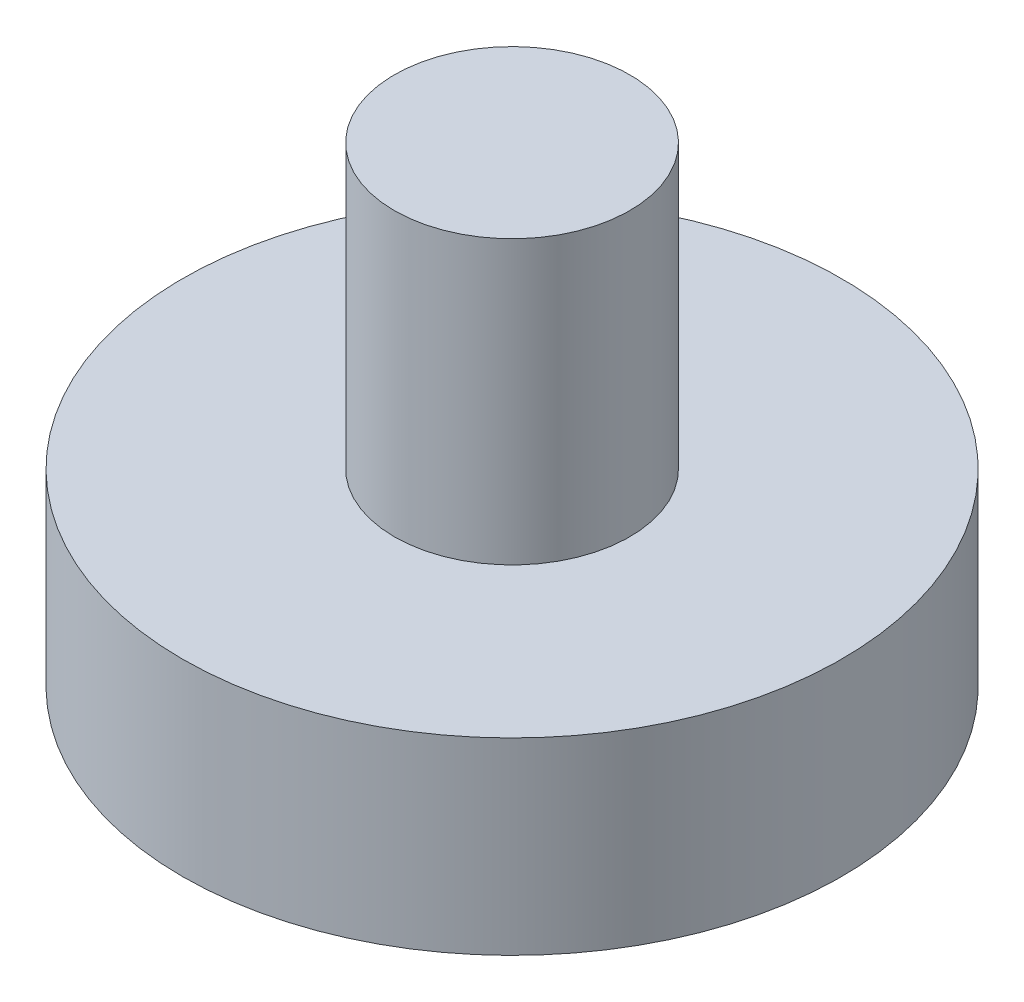
from build123d import *

# Parameters (mm, degrees)
SKETCH1_R           = 3.5
BOSS_EXTRUDE1_DEPTH = 2
SKETCH2_R           = 1.25
BOSS_EXTRUDE2_DEPTH = 3


with BuildPart() as part:
    # Sketch1 → Boss-Extrude1 (new body)
    with BuildSketch(Plane(origin=(0, 0, 0), x_dir=(1, 0, 0), z_dir=(0, 1, 0))):
        with Locations(Location((0, 0, 0), (0, 0, 270))):
            Circle(SKETCH1_R)
    extrude(amount=BOSS_EXTRUDE1_DEPTH)

    # Sketch2 → Boss-Extrude2 (add)
    with BuildSketch(Plane(origin=(0, 2, 0), x_dir=(1, 0, 0), z_dir=(0, 1, 0))):
        with Locations(Location((0, 0, 0), (0, 0, 270))):
            Circle(SKETCH2_R)
    extrude(amount=BOSS_EXTRUDE2_DEPTH)


solid = part.part
